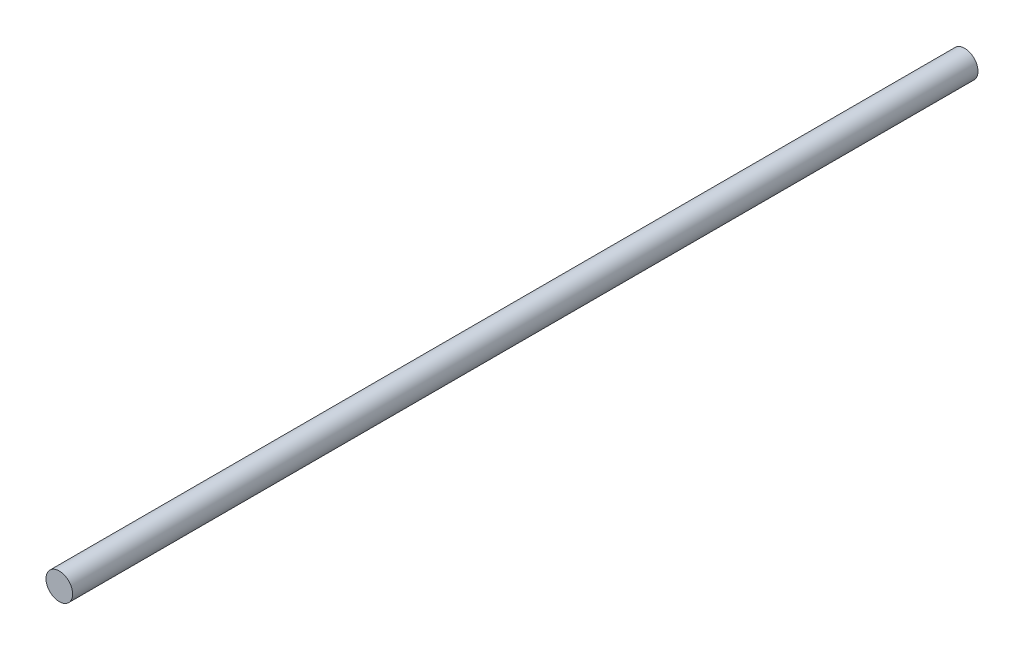
from build123d import *

# Parameters (mm, degrees)
SKETCH_1_R      = 3
EXTRUDE_1_DEPTH = 204


with BuildPart() as part:
    # 스케치1 → 보스-돌출1 (new body)
    with BuildSketch(Plane.XY):
        Circle(SKETCH_1_R)
    extrude(amount=EXTRUDE_1_DEPTH)


solid = part.part
